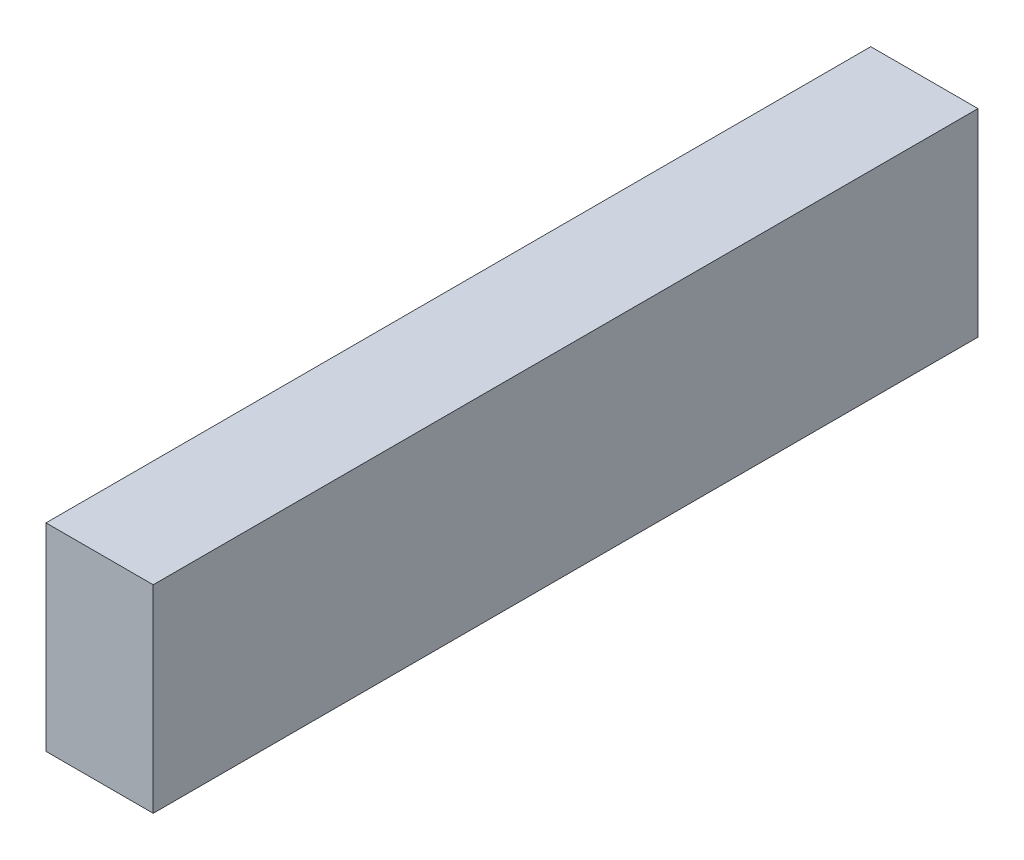
from build123d import *

# Parameters (mm, degrees)
SKETCH_1_W      = 13
SKETCH_1_H      = 24
EXTRUDE_1_DEPTH = 100


with BuildPart() as part:
    # 草圖1 → 填料-伸長1 (new body)
    with BuildSketch(Plane.XY):
        Rectangle(SKETCH_1_W, SKETCH_1_H)
    extrude(amount=EXTRUDE_1_DEPTH)


solid = part.part
